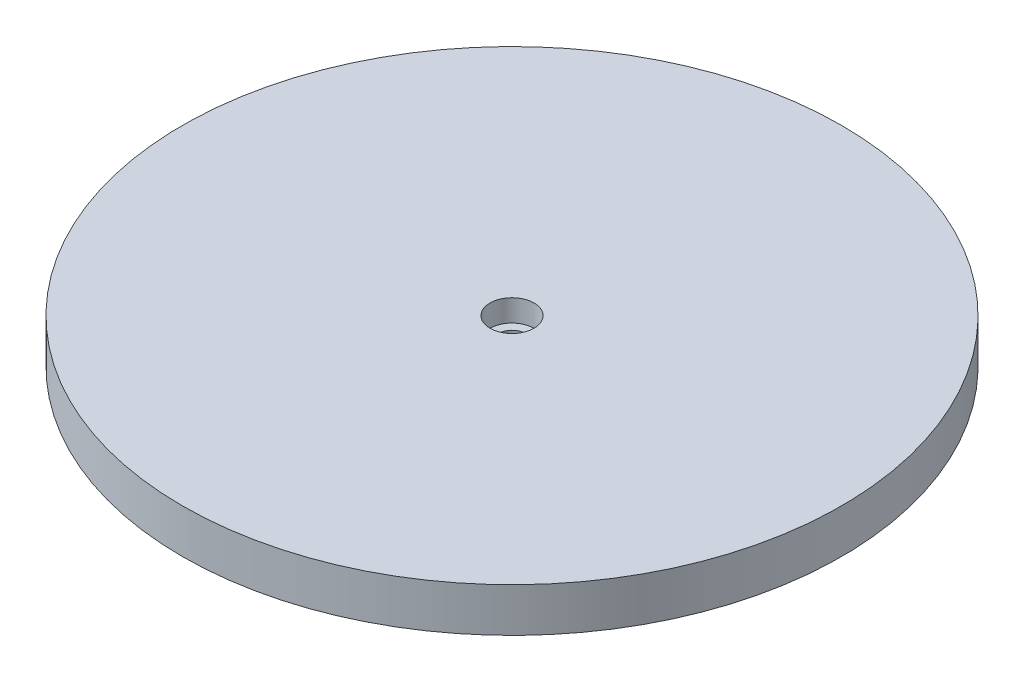
from build123d import *

# Parameters (mm, degrees)
SKETCH_1_R          = 15
EXTRUDE_1_DEPTH     = 2
SKETCH_2_R          = 0.6
CUT_EXTRUDE_1_DEPTH = 22.307275753
SKETCH_2_3_R        = 1
CUT_EXTRUDE_2_DEPTH = 1


with BuildPart() as part:
    # 草图1 → 凸台-拉伸1 (new body)
    with BuildSketch(Plane(origin=(0, 0, 0), x_dir=(1, 0, 0), z_dir=(0, 1, 0))):
        Circle(SKETCH_1_R)
    extrude(amount=EXTRUDE_1_DEPTH)

    # 草图2 → 切除-拉伸1 (cut, through all)
    with BuildSketch(Plane(origin=(0, 2, 0), x_dir=(1, 0, 0), z_dir=(0, 1, 0))):
        Circle(SKETCH_2_R)
    extrude(amount=-CUT_EXTRUDE_1_DEPTH, mode=Mode.SUBTRACT)

    # 草图2<3> → 切除-拉伸2 (cut)
    with BuildSketch(Plane(origin=(0, 2, 0), x_dir=(1, 0, 0), z_dir=(0, 1, 0))):
        Circle(SKETCH_2_3_R)
    extrude(amount=-CUT_EXTRUDE_2_DEPTH, mode=Mode.SUBTRACT)


solid = part.part
